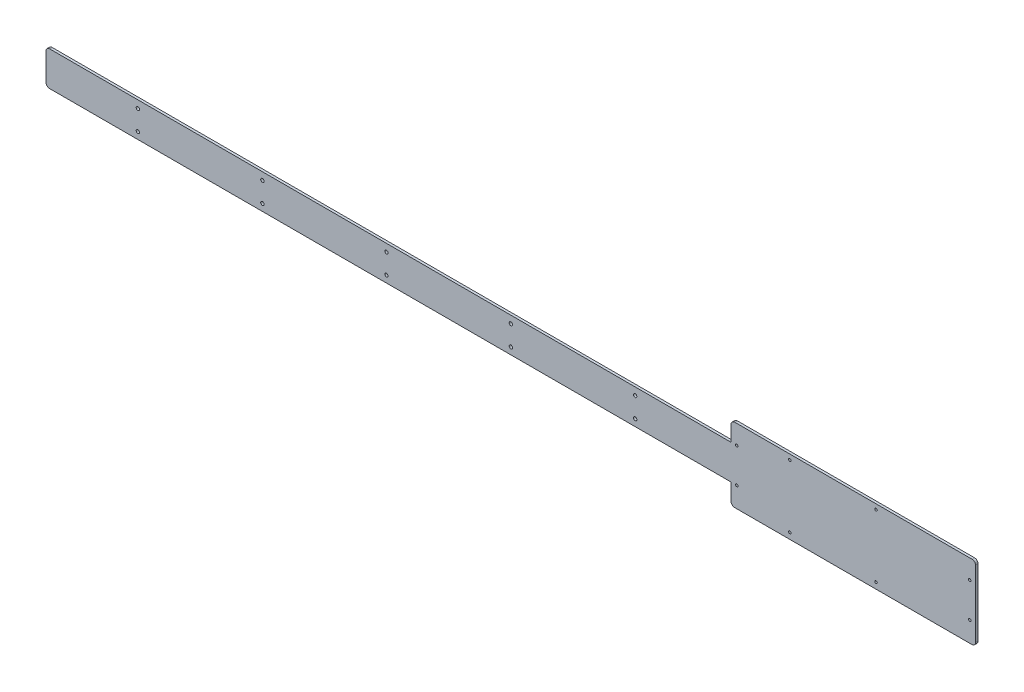
from build123d import *

# Parameters (mm, degrees)
SKETCH1_R           = 1.720095417
SKETCH1_R_2         = 1.632335783
SKETCH1_R_3         = 1.27
BOSS_EXTRUDE1_DEPTH = 2.54


with BuildPart() as part:
    # Sketch1 → Boss-Extrude1 (new body)
    with BuildSketch(Plane.XY):
        with BuildLine():
            Line((0.359622665, 112.547896558), (0.359622665, 84.647626996))
            ThreePointArc((0.359622665, 84.647626996), (1.569547298, 82.016705042), (4.285435965, 81.011908201))
            Line((4.285435965, 81.011908201), (699.960441306, 81.011908201))
            Line((699.960441306, 81.011908201), (699.960441306, 64.012598058))
            ThreePointArc((699.960441306, 64.012598058), (701.213068629, 61.288906282), (704.024750828, 60.24870663))
            Line((704.024750828, 60.24870663), (946.192785632, 60.24870663))
            ThreePointArc((946.192785632, 60.24870663), (948.74540471, 61.39621374), (949.738968911, 64.012598058))
            Line((949.738968911, 64.012598058), (949.738968911, 132.475411377))
            ThreePointArc((949.738968911, 132.475411377), (948.657072186, 134.878542119), (946.192785632, 135.812795653))
            Line((946.192785632, 135.812795653), (704.024750828, 135.812795653))
            ThreePointArc((704.024750828, 135.812795653), (701.183091811, 134.700225562), (699.960441306, 131.904163347))
            Line((699.960441306, 131.904163347), (699.960441306, 116.18243367))
            Line((699.960441306, 116.18243367), (4.285435965, 116.18243367))
            ThreePointArc((4.285435965, 116.18243367), (1.569792033, 115.17822767), (0.359622665, 112.547896558))
        make_face()
        with Locations((94.1622142, 88.091107164)):
            Circle(SKETCH1_R, mode=Mode.SUBTRACT)
        with Locations((221.392126764, 88.091107164)):
            Circle(SKETCH1_R, mode=Mode.SUBTRACT)
        with Locations((348.078760153, 88.091107164)):
            Circle(SKETCH1_R_2, mode=Mode.SUBTRACT)
        with Locations((760.070975046, 66.505299661)):
            Circle(SKETCH1_R_3, mode=Mode.SUBTRACT)
        with Locations((848.138968911, 66.505299661)):
            Circle(SKETCH1_R_3, mode=Mode.SUBTRACT)
        with Locations((475.146430575, 88.091107164)):
            Circle(SKETCH1_R, mode=Mode.SUBTRACT)
        with Locations((705.892847696, 81.011908201)):
            Circle(SKETCH1_R_3, mode=Mode.SUBTRACT)
        with Locations((602.130384222, 88.091107164)):
            Circle(SKETCH1_R, mode=Mode.SUBTRACT)
        with Locations((943.890172073, 81.011908201)):
            Circle(SKETCH1_R_3, mode=Mode.SUBTRACT)
        with Locations((94.1622142, 108.484732819)):
            Circle(SKETCH1_R, mode=Mode.SUBTRACT)
        with Locations((221.392126764, 108.484732819)):
            Circle(SKETCH1_R, mode=Mode.SUBTRACT)
        with Locations((348.078760153, 108.484732819)):
            Circle(SKETCH1_R, mode=Mode.SUBTRACT)
        with Locations((475.146430575, 108.484732819)):
            Circle(SKETCH1_R, mode=Mode.SUBTRACT)
        with Locations((602.130384222, 108.484732819)):
            Circle(SKETCH1_R, mode=Mode.SUBTRACT)
        with Locations((705.892847696, 116.18243367)):
            Circle(SKETCH1_R_3, mode=Mode.SUBTRACT)
        with Locations((943.890172073, 116.18243367)):
            Circle(SKETCH1_R_3, mode=Mode.SUBTRACT)
        with Locations((760.070975046, 130.611938178)):
            Circle(SKETCH1_R_3, mode=Mode.SUBTRACT)
        with Locations((848.138968911, 130.611938178)):
            Circle(SKETCH1_R_3, mode=Mode.SUBTRACT)
    extrude(amount=BOSS_EXTRUDE1_DEPTH)


solid = part.part
